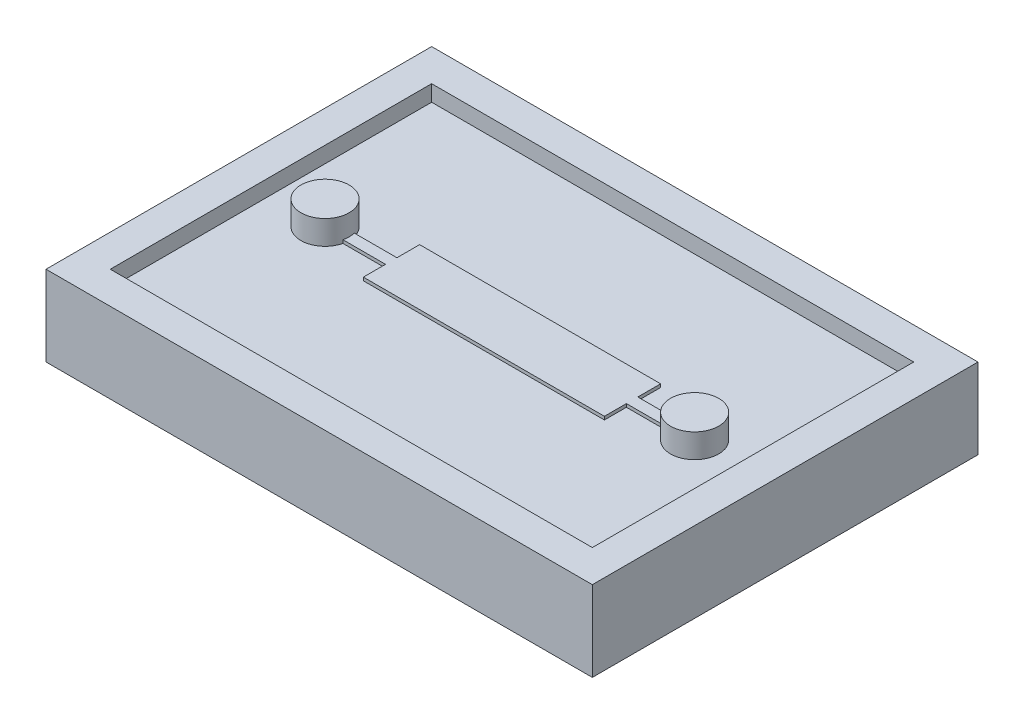
from build123d import *

# Parameters (mm, degrees)
CROQUIS1_W               = 34
CROQUIS1_H               = 24
SALIENTE_EXTRUIR1_DEPTH  = 3
CROQUIS2_W               = 30
CROQUIS2_H               = 20
CORTAR_EXTRUIR1_DEPTH    = 1
CROQUIS6_R               = 1.5
SALIENTE_EXTRUIR3_DEPTH  = 1.5
MATRIZL1_COUNT           = 2
MATRIZL1_PITCH           = 23
CROQUIS8_W               = 5
CROQUIS8_H               = 0.71
SALIENTE_EXTRUIR5_DEPTH  = 0.2
CROQUIS10_W              = 5
CROQUIS10_H              = 0.71
SALIENTE_EXTRUIR6_DEPTH  = 0.2
CROQUIS18_W              = 15
CROQUIS18_H              = 3.5
SALIENTE_EXTRUIR8_DEPTH  = 0.2
CROQUIS23_W              = 34
CROQUIS23_H              = 24
SALIENTE_EXTRUIR11_DEPTH = 2


with BuildPart() as part:
    # Croquis1 → Saliente-Extruir1 (new body)
    with BuildSketch(Plane(origin=(0, 0, 0), x_dir=(1, 0, 0), z_dir=(0, 1, 0))):
        Rectangle(CROQUIS1_W, CROQUIS1_H)
    extrude(amount=SALIENTE_EXTRUIR1_DEPTH)

    # Croquis2 → Cortar-Extruir1 (cut)
    with BuildSketch(Plane(origin=(0, 3, 0), x_dir=(1, 0, 0), z_dir=(0, 1, 0))):
        Rectangle(CROQUIS2_W, CROQUIS2_H)
    extrude(amount=-CORTAR_EXTRUIR1_DEPTH, mode=Mode.SUBTRACT)

    # Croquis6 → Saliente-Extruir3 (add)
    with BuildSketch(Plane(origin=(-1.755264317, 2, -0.109917309), x_dir=(1, 0, 0), z_dir=(0, 1, 0))):
        with Locations(Location((-9.854739848, -0.135008356, 0), (0, 0, 270))):
            Circle(CROQUIS6_R)
    saliente_extruir3 = extrude(amount=SALIENTE_EXTRUIR3_DEPTH)

    # MatrizL1: Saliente-Extruir3 ×2
    with Locations(*[(i * MATRIZL1_PITCH, 0, 0) for i in range(1, MATRIZL1_COUNT)]):
        add(saliente_extruir3)

    # Croquis8 → Saliente-Extruir5 (add)
    with BuildSketch(Plane(origin=(0, 2, 0.512947444), x_dir=(1, 0, 0), z_dir=(0, 1, 0))):
        with Locations((-9.175591951, 0.49731844)):
            Rectangle(CROQUIS8_W, CROQUIS8_H)
    extrude(amount=SALIENTE_EXTRUIR5_DEPTH)

    # Croquis10 → Saliente-Extruir6 (add)
    with BuildSketch(Plane(origin=(3.639202125, 2, -0.512947444), x_dir=(1, 0, 0), z_dir=(0, 1, 0))):
        with Locations((5.490278272, -0.538512576)):
            Rectangle(CROQUIS10_W, CROQUIS10_H)
    extrude(amount=SALIENTE_EXTRUIR6_DEPTH)

    # Croquis18 → Saliente-Extruir8 (add)
    with BuildSketch(Plane(origin=(0, 2, 0), x_dir=(1, 0, 0), z_dir=(0, 1, 0))):
        Rectangle(CROQUIS18_W, CROQUIS18_H)
    extrude(amount=SALIENTE_EXTRUIR8_DEPTH)

    # Croquis23 → Saliente-Extruir11 (add)
    with BuildSketch(Plane.XZ):
        Rectangle(CROQUIS23_W, CROQUIS23_H)
    extrude(amount=SALIENTE_EXTRUIR11_DEPTH)


solid = part.part
